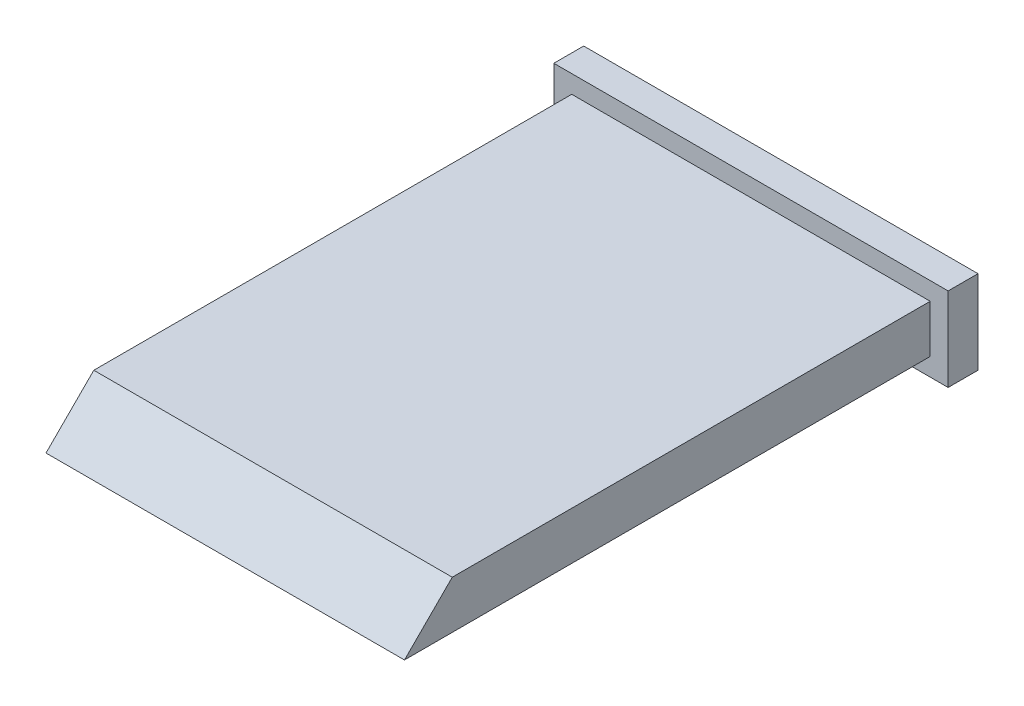
from build123d import *

# Parameters (mm, degrees)
BOSS_EXTRUDE1_DEPTH = 60
SKETCH3_W           = 66
SKETCH3_H           = 14
BOSS_EXTRUDE2_DEPTH = 5


with BuildPart() as part:
    # Sketch1 → Boss-Extrude1 (new body)
    with BuildSketch(Plane(origin=(0, 0, 0), x_dir=(0, 0, -1), z_dir=(1, 0, 0))):
        Polygon((0, 0), (8, 8), (88, 8), (88, 0), align=None)
    extrude(amount=BOSS_EXTRUDE1_DEPTH)

    # Sketch3 → Boss-Extrude2 (add)
    with BuildSketch(Plane(origin=(0, 0, -88), x_dir=(-1, 0, 0), z_dir=(0, 0, -1))):
        with Locations((-30, 4)):
            Rectangle(SKETCH3_W, SKETCH3_H)
    extrude(amount=BOSS_EXTRUDE2_DEPTH)


solid = part.part
